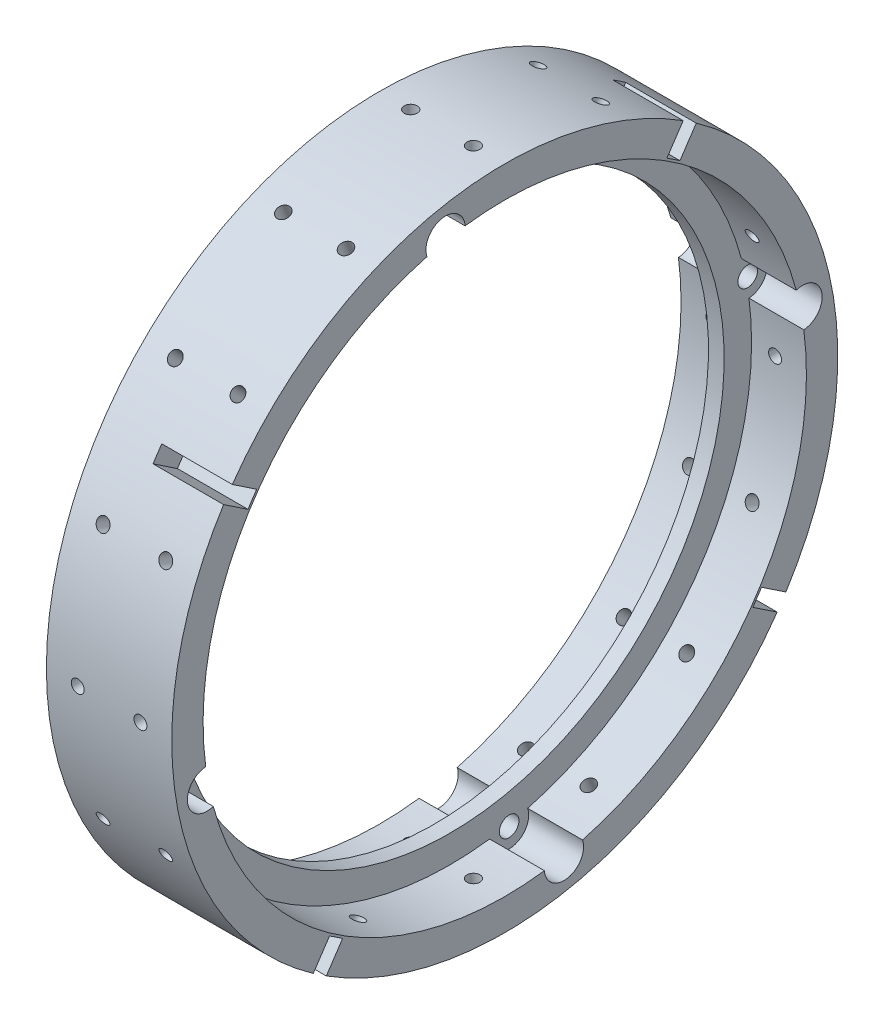
from build123d import *

# Parameters (mm, degrees)
SKETCH3_R          = 1.65
CUT_EXTRUDE3_DEPTH = 120
CIRPATTERN1_COUNT  = 16
CUT_EXTRUDE4_DEPTH = 18
CIRPATTERN2_COUNT  = 4
SKETCH5_R          = 5
CUT_EXTRUDE5_DEPTH = 14
SKETCH6_R          = 2.5
CUT_EXTRUDE6_DEPTH = 20
SKETCH7_R          = 5
CUT_EXTRUDE7_DEPTH = 20
CIRPATTERN3_COUNT  = 4


with BuildPart() as part:
    # Sketch2 → Revolve1 (revolve)
    with BuildSketch(Plane.XY, mode=Mode.PRIVATE) as revolve1_sk:
        Polygon((0, 70), (4, 70), (4, 77), (18, 77), (18, 85), (-14, 85), (-14, 77), (0, 77), align=None)
    revolve(revolve1_sk.sketch.rotate(Axis((-206.00422833, 0, 0), (1, 0, 0)), 90), axis=Axis((-206.00422833, 0, 0), (1, 0, 0)))

    # Sketch3 → Cut-Extrude3 (cut)
    with BuildSketch(Plane.XY):
        with Locations((-6, 0)):
            Circle(SKETCH3_R)
        with Locations((10, 0)):
            Circle(SKETCH3_R)
    cut_extrude3 = extrude(amount=-CUT_EXTRUDE3_DEPTH, mode=Mode.SUBTRACT)

    # CirPattern1: Cut-Extrude3 ×16 about axis
    cirpattern1_axis = Axis((-206.00422833, 0, 0), (-1, 0, 0))
    for i in range(1, CIRPATTERN1_COUNT):
        add(cut_extrude3.rotate(cirpattern1_axis, i * 360 / CIRPATTERN1_COUNT), mode=Mode.SUBTRACT)

    # Sketch4 → Cut-Extrude4 (cut)
    with BuildSketch(Plane.ZY):
        Polygon((-44.719632284, 63.327754487), (-51.38647508, 73.305389835), (-48.060596631, 75.527670767), (-41.393753834, 65.550035419), align=None)
    cut_extrude4 = extrude(amount=-CUT_EXTRUDE4_DEPTH, mode=Mode.SUBTRACT)

    # CirPattern2: Cut-Extrude4 ×4 about axis
    cirpattern2_axis = Axis((0, 0, 0), (1, 0, 0))
    for i in range(1, CIRPATTERN2_COUNT):
        add(cut_extrude4.rotate(cirpattern2_axis, i * 360 / CIRPATTERN2_COUNT), mode=Mode.SUBTRACT)

    # Sketch5 → Cut-Extrude5 (cut)
    with BuildSketch(Plane(origin=(18, 0, 0), x_dir=(0, 0, -1), z_dir=(1, 0, 0))):
        with Locations((-76.010859231, -15.119499956)):
            Circle(SKETCH5_R)
    cut_extrude5 = extrude(amount=-CUT_EXTRUDE5_DEPTH, mode=Mode.SUBTRACT)

    # Sketch6 → Cut-Extrude6 (cut)
    with BuildSketch(Plane(origin=(4, 0, 0), x_dir=(0, 0, -1), z_dir=(1, 0, 0))):
        with Locations((-76.010859231, -15.119499956)):
            Circle(SKETCH6_R)
    cut_extrude6 = extrude(amount=-CUT_EXTRUDE6_DEPTH, mode=Mode.SUBTRACT)

    # Sketch7 → Cut-Extrude7 (cut)
    with BuildSketch(Plane.ZY):
        with Locations((76.010859231, -15.119499956)):
            Circle(SKETCH7_R)
    cut_extrude7 = extrude(amount=CUT_EXTRUDE7_DEPTH, mode=Mode.SUBTRACT)

    # CirPattern3: Cut-Extrude5, Cut-Extrude6, Cut-Extrude7 ×4 about axis
    cirpattern3_axis = Axis((0, 0, 0), (1, 0, 0))
    add([cut_extrude5.rotate(cirpattern3_axis, i * 360 / CIRPATTERN3_COUNT) for i in range(1, CIRPATTERN3_COUNT)], mode=Mode.SUBTRACT)
    add([cut_extrude6.rotate(cirpattern3_axis, i * 360 / CIRPATTERN3_COUNT) for i in range(1, CIRPATTERN3_COUNT)], mode=Mode.SUBTRACT)
    add([cut_extrude7.rotate(cirpattern3_axis, i * 360 / CIRPATTERN3_COUNT) for i in range(1, CIRPATTERN3_COUNT)], mode=Mode.SUBTRACT)


solid = part.part
